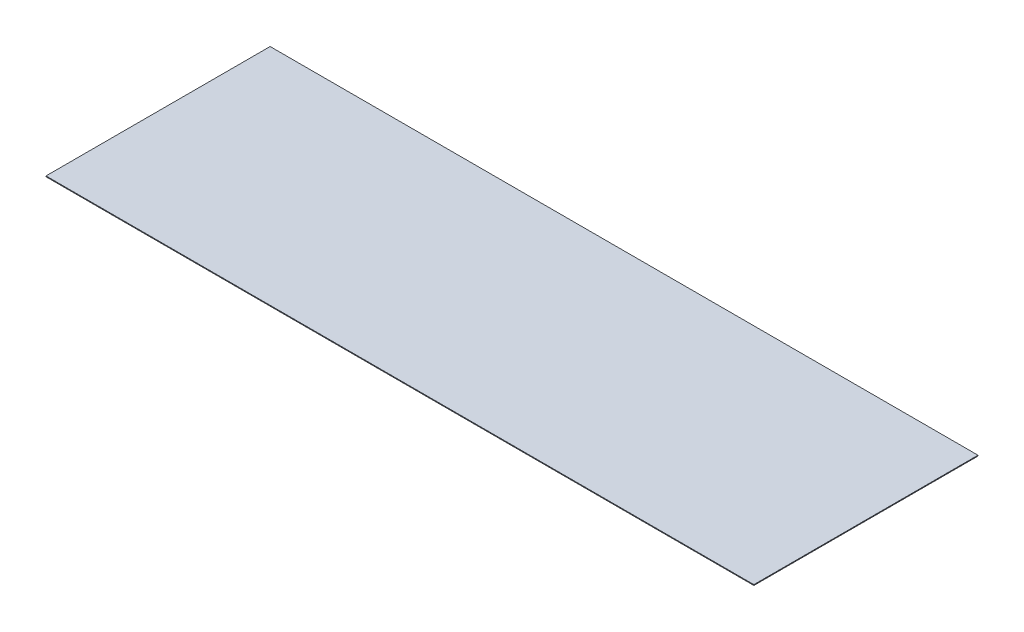
from build123d import *

# Parameters (mm, degrees)
SKETCH1_W           = 560.1904
SKETCH1_H           = 177.36
BOSS_EXTRUDE1_DEPTH = 0.6096


with BuildPart() as part:
    # Sketch1 → Boss-Extrude1 (new body)
    with BuildSketch(Plane(origin=(0, 0, 0), x_dir=(1, 0, 0), z_dir=(0, 1, 0))):
        with Locations((19.5698, 0)):
            Rectangle(SKETCH1_W, SKETCH1_H)
    extrude(amount=BOSS_EXTRUDE1_DEPTH)


solid = part.part
